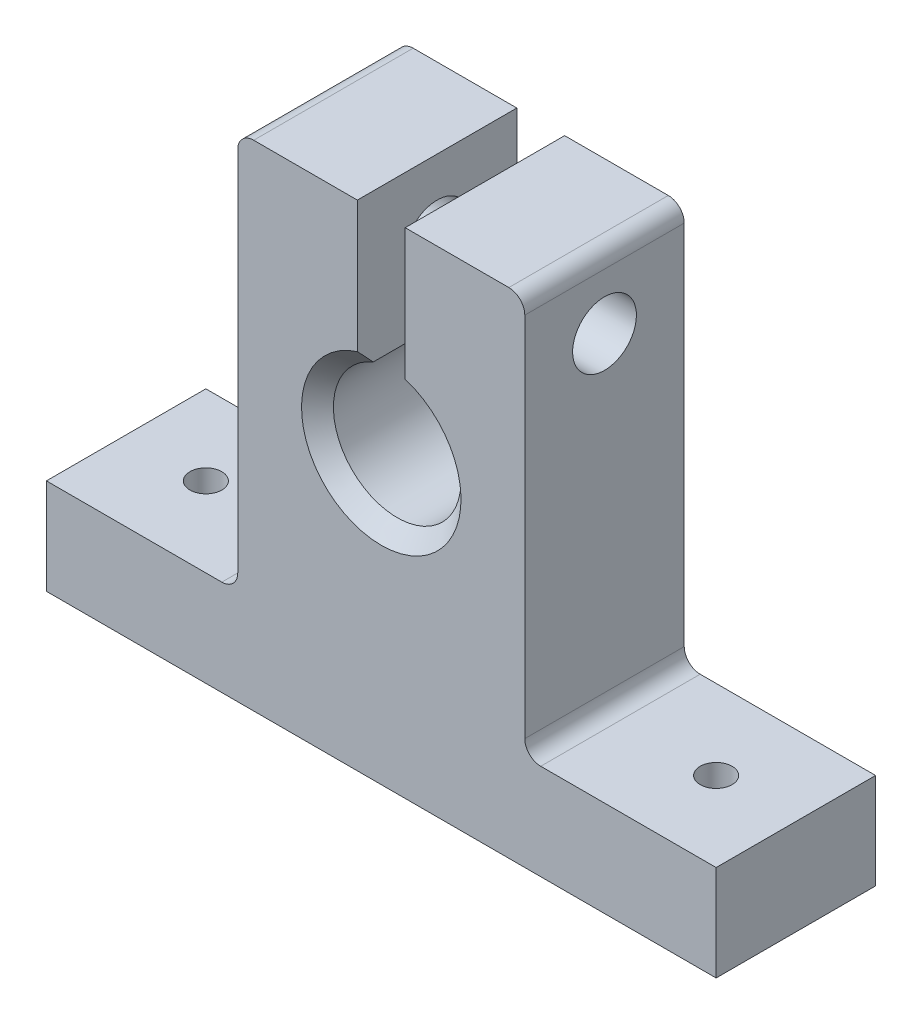
from build123d import *

# Parameters (mm, degrees)
SKETCH1_W           = 42
SKETCH1_H           = 6
BOSS_EXTRUDE1_DEPTH = 14
BOSS_EXTRUDE2_DEPTH = 14
SKETCH3_R           = 4
CUT_EXTRUDE1_DEPTH  = 14
SKETCH4_R           = 1
CUT_EXTRUDE2_DEPTH  = 14
FILLET1_R           = 1
FILLET2_R           = 1
FILLET3_R           = 1
FILLET4_R           = 1
CHAMFER1_SIZE       = 1
CHAMFER2_SIZE       = 1
CUT_EXTRUDE4_DEPTH  = 14
SKETCH7_R           = 2
CUT_EXTRUDE5_DEPTH  = 24
SKETCH10_W          = 63.901140572
SKETCH10_H          = 43.979020276
CUT_EXTRUDE8_DEPTH  = 2
SKETCH11_W          = 62.872788093
SKETCH11_H          = 44.7095382
CUT_EXTRUDE9_DEPTH  = 2
CHAMFER3_SIZE       = 1
CHAMFER4_SIZE       = 1


with BuildPart() as part:
    # Sketch1 → Boss-Extrude1 (new body)
    with BuildSketch(Plane.XY):
        Rectangle(SKETCH1_W, SKETCH1_H)
    extrude(amount=BOSS_EXTRUDE1_DEPTH)

    # Sketch2 → Boss-Extrude2 (add)
    with BuildSketch(Plane.XY.offset(14)):
        Polygon((0, 28), (-9, 28), (-9, 3), (9, 3), (9, 28), align=None)
    extrude(amount=-BOSS_EXTRUDE2_DEPTH)

    # Sketch3 → Cut-Extrude1 (cut)
    with BuildSketch(Plane.XY.offset(14)):
        with Locations((0, 15)):
            Circle(SKETCH3_R)
    extrude(amount=-CUT_EXTRUDE1_DEPTH, mode=Mode.SUBTRACT)

    # Sketch4 → Cut-Extrude2 (cut)
    with BuildSketch(Plane.XZ.offset(3)):
        with Locations(Location((-16, 7, 0), (0, 0, 270))):
            Circle(SKETCH4_R)
        with Locations(Location((16, 7, 0), (0, 0, 270))):
            Circle(SKETCH4_R)
    extrude(amount=-CUT_EXTRUDE2_DEPTH, mode=Mode.SUBTRACT)

    # Fillet1
    fillet1_edges = [part.edges().sort_by_distance(p)[0] for p in [
        (-9, 3, 7),
    ]]
    fillet(fillet1_edges, radius=FILLET1_R)

    # Fillet2
    fillet2_edges = [part.edges().sort_by_distance(p)[0] for p in [
        (9, 3, 7),
    ]]
    fillet(fillet2_edges, radius=FILLET2_R)

    # Fillet3
    fillet3_edges = [part.edges().sort_by_distance(p)[0] for p in [
        (-9, 28, 7),
    ]]
    fillet(fillet3_edges, radius=FILLET3_R)

    # Fillet4
    fillet4_edges = [part.edges().sort_by_distance(p)[0] for p in [
        (9, 28, 7),
    ]]
    fillet(fillet4_edges, radius=FILLET4_R)

    # Chamfer1
    chamfer1_edges = [part.edges().sort_by_distance(p)[0] for p in [
        (-4, 15, 14),
    ]]
    chamfer(chamfer1_edges, length=CHAMFER1_SIZE)

    # Chamfer2
    chamfer2_edges = [part.edges().sort_by_distance(p)[0] for p in [
        (-4, 15, 0),
    ]]
    chamfer(chamfer2_edges, length=CHAMFER2_SIZE)

    # Sketch6 → Cut-Extrude4 (cut)
    with BuildSketch(Plane.XY.offset(14)):
        with BuildLine():
            Line((0, 28), (-1.5, 28))
            Line((-1.5, 28), (-1.5, 18.708099244))
            ThreePointArc((-1.5, 18.708099244), (0, 19), (1.5, 18.708099244))
            Line((1.5, 18.708099244), (1.5, 28))
            Line((1.5, 28), (0, 28))
        make_face()
    extrude(amount=-CUT_EXTRUDE4_DEPTH, mode=Mode.SUBTRACT)

    # Sketch7 → Cut-Extrude5 (cut)
    with BuildSketch(Plane(origin=(9, 0, 0), x_dir=(0, 0, -1), z_dir=(1, 0, 0))):
        with Locations(Location((-7, 23.5, 0), (0, 0, 90))):
            Circle(SKETCH7_R)
    extrude(amount=-CUT_EXTRUDE5_DEPTH, mode=Mode.SUBTRACT)

    # Sketch10 → Cut-Extrude8 (cut)
    with BuildSketch(Plane.XY.offset(14)):
        with Locations((1.003303608, 14.168104251)):
            Rectangle(SKETCH10_W, SKETCH10_H)
    extrude(amount=-CUT_EXTRUDE8_DEPTH, mode=Mode.SUBTRACT)

    # Sketch11 → Cut-Extrude9 (cut)
    with BuildSketch(Plane(origin=(0, 0, 0), x_dir=(-1, 0, 0), z_dir=(0, 0, -1))):
        with Locations((3.111885471, 13.654031467)):
            Rectangle(SKETCH11_W, SKETCH11_H)
    extrude(amount=-CUT_EXTRUDE9_DEPTH, mode=Mode.SUBTRACT)

    # Chamfer3
    chamfer3_edges = [part.edges().sort_by_distance(p)[0] for p in [
        (0, 11, 12),
    ]]
    chamfer(chamfer3_edges, length=CHAMFER3_SIZE)

    # Chamfer4
    chamfer4_edges = [part.edges().sort_by_distance(p)[0] for p in [
        (0, 11, 2),
    ]]
    chamfer(chamfer4_edges, length=CHAMFER4_SIZE)


solid = part.part
